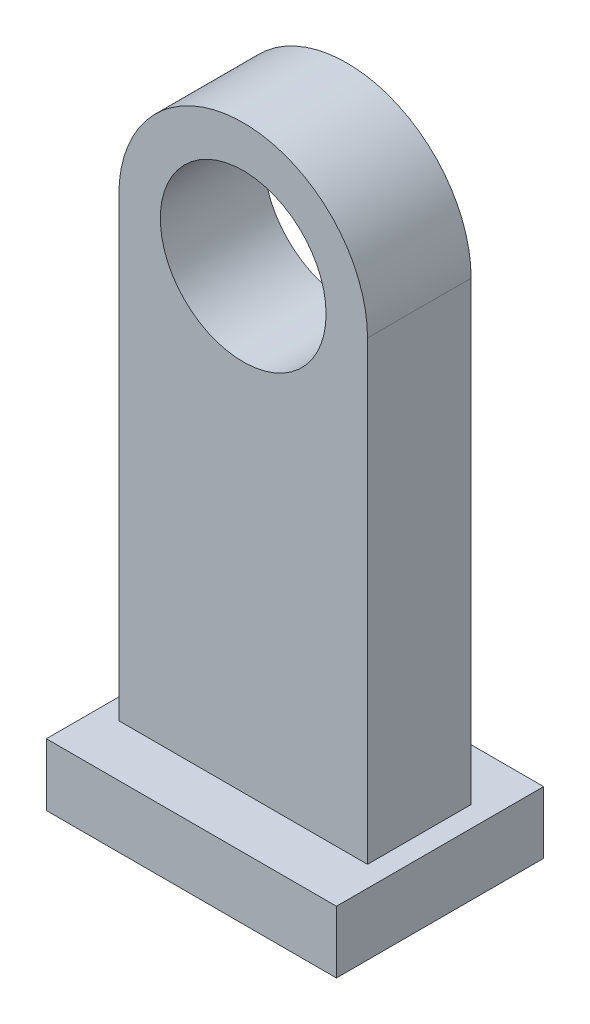
from build123d import *

# Parameters (mm, degrees)
SKETCH1_R               = 6
SKETCH1_R_2             = 4
BOSS_EXTRUDE1_DEPTH     = 5
SKETCH2_W               = 12
SKETCH2_H               = 5
BOSS_EXTRUDE2_DEPTH     = 22
CUT_EXTRUDE1_DEPTH      = 24.34523506
CUT_EXTRUDE1_DEPTH_BACK = 24.34523506
SKETCH5_R               = 4
SKETCH6_W               = 14
SKETCH6_H               = 10
BOSS_EXTRUDE3_DEPTH     = 3


with BuildPart() as part:
    # Sketch1 → Boss-Extrude1 (new body)
    with BuildSketch(Plane.XY):
        Circle(SKETCH1_R)
        Circle(SKETCH1_R_2, mode=Mode.SUBTRACT)
    extrude(amount=BOSS_EXTRUDE1_DEPTH)

    # Sketch2 → Boss-Extrude2 (add)
    with BuildSketch(Plane(origin=(0, 0, 0), x_dir=(1, 0, 0), z_dir=(0, 1, 0))):
        with Locations((0, -2.5)):
            Rectangle(SKETCH2_W, SKETCH2_H)
    extrude(amount=-BOSS_EXTRUDE2_DEPTH)

    # Sketch5 → Cut-Extrude1 (cut, two sides: drawn at the far end of the back side and taken through both)
    with BuildSketch(Plane.XY.offset(5).offset(-CUT_EXTRUDE1_DEPTH_BACK)):
        Circle(SKETCH5_R)
    extrude(amount=CUT_EXTRUDE1_DEPTH + CUT_EXTRUDE1_DEPTH_BACK, mode=Mode.SUBTRACT)

    # Sketch6 → Boss-Extrude3 (add)
    with BuildSketch(Plane.XZ.offset(22)):
        with Locations((0, 2.5)):
            Rectangle(SKETCH6_W, SKETCH6_H)
    extrude(amount=BOSS_EXTRUDE3_DEPTH)


solid = part.part
